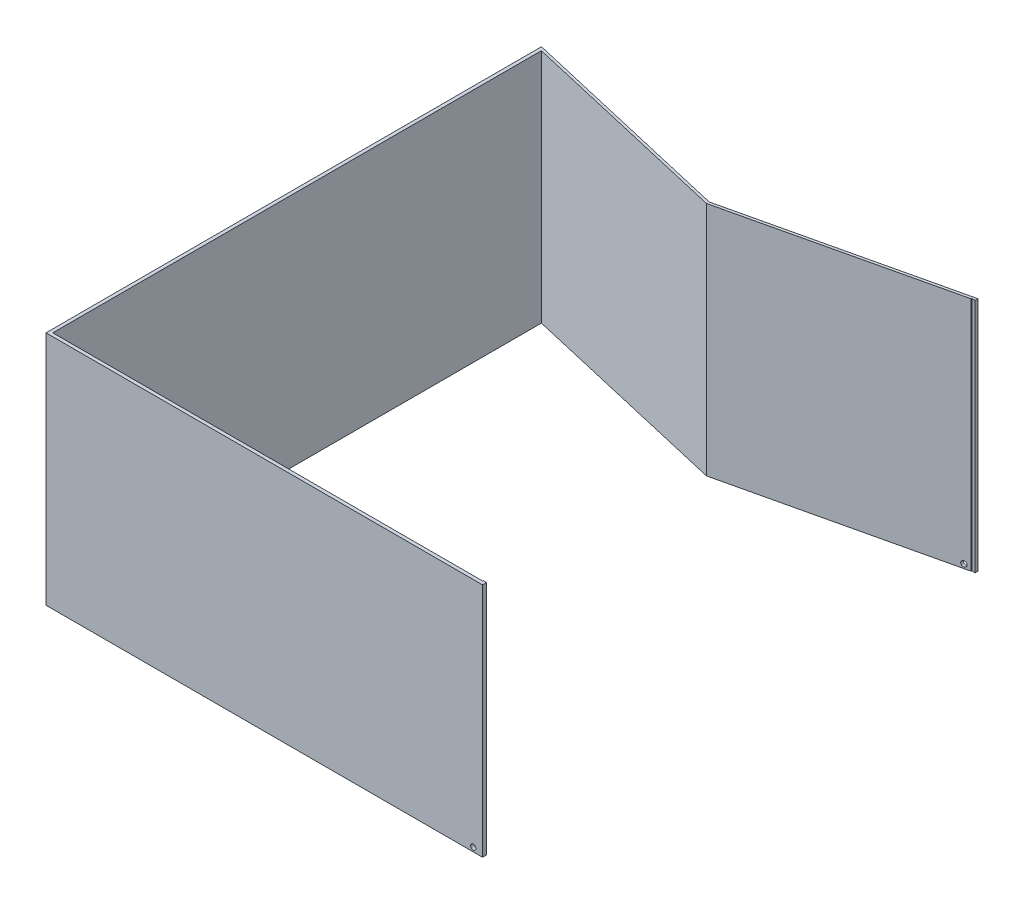
from build123d import *

# Parameters (mm, degrees)
BOSS_EXTRUDE1_DEPTH = 355.6
SKETCH8_W           = 736.392149349
SKETCH8_H           = 355.6
CUT_EXTRUDE2_DEPTH  = 5.08
CUT_EXTRUDE4_REACH  = 892.111
SKETCH12_R          = 3.9624


with BuildPart() as part:
    # Sketch2 → Boss-Extrude1 (new body)
    with BuildSketch(Plane(origin=(0, 0, 0), x_dir=(1, 0, 0), z_dir=(0, 1, 0))):
        Polygon((-328.93, -373.38), (328.93, -373.38), (328.93, 373.38), (0, 297.18), (-328.93, 373.38), align=None)
        Polygon((-323.85, -368.3), (323.85, -368.3), (323.85, 368.159900717), (0, 293.136734694), (-323.85, 368.159900717), align=None, mode=Mode.SUBTRACT)
    extrude(amount=BOSS_EXTRUDE1_DEPTH)

    # Sketch8 → Cut-Extrude2 (cut)
    with BuildSketch(Plane(origin=(328.93, 0, 0), x_dir=(0, 0, -1), z_dir=(1, 0, 0))):
        with Locations((0.86314386, 177.8)):
            Rectangle(SKETCH8_W, SKETCH8_H)
    extrude(amount=-CUT_EXTRUDE2_DEPTH, mode=Mode.SUBTRACT)

    # Cut-Extrude4: up to this plane
    cut_extrude4_end = Plane(origin=(328.93, 355.6, -373.38), z_dir=(0.22568355160076956, 0, 0.9742006644099884))
    # Sketch12 → Cut-Extrude4 (cut, up to the surface)
    with BuildSketch(Plane.XY.offset(373.38), mode=Mode.PRIVATE) as cut_extrude4_sk1:
        with Locations(Location((315.000794765, 6.297541098, 0), (0, 0, 180))):
            Circle(SKETCH12_R)
    cut_extrude4_tool1 = split(extrude(cut_extrude4_sk1.sketch, amount=-CUT_EXTRUDE4_REACH, mode=Mode.PRIVATE), bisect_by=cut_extrude4_end, keep=Keep.BOTH, mode=Mode.PRIVATE)
    add(cut_extrude4_tool1.solids().sort_by_distance((315.000795, 6.297541, 373.38))[0], mode=Mode.SUBTRACT)


solid = part.part
